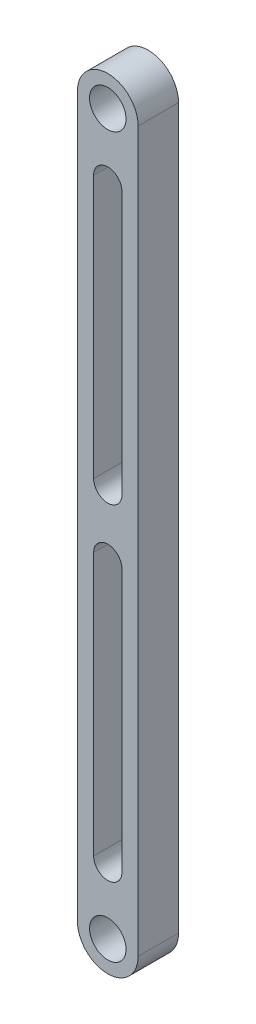
from build123d import *

# Parameters (mm, degrees)
SKETCH1_R           = 4.515
BOSS_EXTRUDE1_DEPTH = 10


with BuildPart() as part:
    # Sketch1 → Boss-Extrude1 (new body)
    with BuildSketch(Plane.XY):
        with BuildLine():
            Line((-7.5, -88.9), (-7.5, 88.9))
            ThreePointArc((-7.5, 88.9), (0, 96.4), (7.5, 88.9))
            Line((7.5, 88.9), (7.5, -88.9))
            ThreePointArc((7.5, -88.9), (0, -96.4), (-7.5, -88.9))
        make_face()
        with Locations((0, -88.9)):
            Circle(SKETCH1_R, mode=Mode.SUBTRACT)
        with Locations((0, 88.9)):
            Circle(SKETCH1_R, mode=Mode.SUBTRACT)
        with BuildLine():
            Line((-3.5, -72.9), (-3.5, -7.9))
            ThreePointArc((-3.5, -7.9), (0, -4.4), (3.5, -7.9))
            Line((3.5, -7.9), (3.5, -72.9))
            ThreePointArc((3.5, -72.9), (0, -76.4), (-3.5, -72.9))
        make_face(mode=Mode.SUBTRACT)
        with BuildLine():
            Line((3.5, 72.9), (3.5, 7.9))
            ThreePointArc((3.5, 7.9), (0, 4.4), (-3.5, 7.9))
            Line((-3.5, 7.9), (-3.5, 72.9))
            ThreePointArc((-3.5, 72.9), (0, 76.4), (3.5, 72.9))
        make_face(mode=Mode.SUBTRACT)
    extrude(amount=BOSS_EXTRUDE1_DEPTH)


solid = part.part
